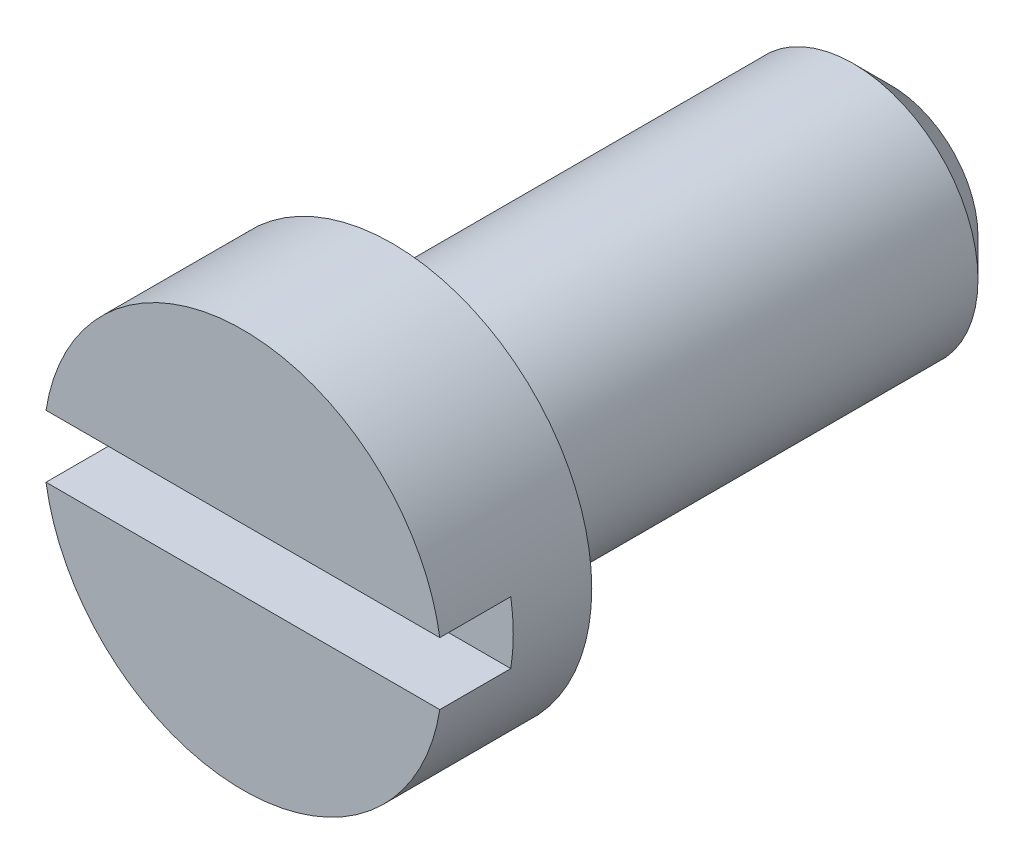
from build123d import *

# Parameters (mm, degrees)
SKETCH_12_R         = 8
EXTRUDE_3_DEPTH     = 6
SKETCH_13_R         = 5
EXTRUDE_4_DEPTH     = 20
SKETCH_20_W         = 17.254901961
SKETCH_20_H         = 2.5
CUT_EXTRUDE_8_DEPTH = 2.85
CHAMFER_1_SIZE      = 1.5


with BuildPart() as part:
    # Эскиз12 → Вытянуть3 (new body)
    with BuildSketch(Plane.XY):
        Circle(SKETCH_12_R)
    extrude(amount=EXTRUDE_3_DEPTH)

    # Эскиз13 → Вытянуть4 (add)
    with BuildSketch(Plane(origin=(0, 0, 0), x_dir=(-1, 0, 0), z_dir=(0, 0, -1))):
        with Locations(Location((0, 0, 0), (0, 0, 180))):
            Circle(SKETCH_13_R)
    extrude(amount=EXTRUDE_4_DEPTH)

    # Эскиз20 → Вырез-Вытянуть8 (cut)
    with BuildSketch(Plane.XY.offset(6)):
        with Locations((-0.054777467, 0)):
            Rectangle(SKETCH_20_W, SKETCH_20_H)
    extrude(amount=-CUT_EXTRUDE_8_DEPTH, mode=Mode.SUBTRACT)

    # Фаска1
    chamfer_1_edges = [part.edges().sort_by_distance(p)[0] for p in [
        (-5, 0, -20),
    ]]
    chamfer(chamfer_1_edges, length=CHAMFER_1_SIZE)


solid = part.part
